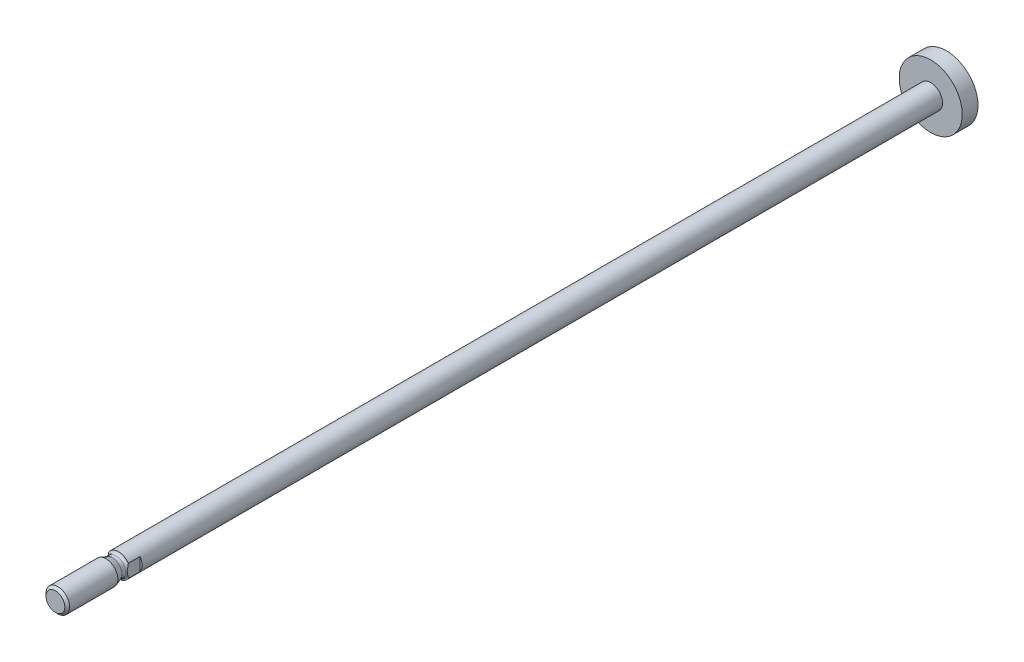
from build123d import *

# Parameters (mm, degrees)
SCHNITT_LINEAR_AUSTRAGEN1_DEPTH = 4


with BuildPart() as part:
    # Skizze1 → Rotation1 (revolve)
    with BuildSketch(Plane(origin=(0, 0, 0), x_dir=(0, 0, -1), z_dir=(1, 0, 0))):
        Polygon((-5, 0), (-5, 3), (201.2, 3), (201.2, 8), (205.2, 8), (205.2, 0), align=None)
    revolve(axis=Axis((0, 0, -205.2), (0, 0, 1)))

    # Skizze2 → Rotation2 (revolve)
    with BuildSketch(Plane(origin=(0, 0, 0), x_dir=(0, 0, -1), z_dir=(1, 0, 0))):
        with BuildLine():
            Line((-21, 0), (-21, 2.3865))
            Line((-21, 2.3865), (-20.3865, 3))
            Line((-20.3865, 3), (-8.148486452, 3))
            Line((-8.148486452, 3), (-6.599415898, 2.436184428))
            ThreePointArc((-6.599415898, 2.436184428), (-6.498392718, 2.409115348), (-6.394203812, 2.4))
            Line((-6.394203812, 2.4), (-5.6, 2.4))
            ThreePointArc((-5.6, 2.4), (-5.175735931, 2.575735931), (-5, 3))
            Line((-5, 3), (-4, 3))
            Line((-4, 3), (-4, 0))
            Line((-4, 0), (-21, 0))
        make_face()
    revolve(axis=Axis((0, 0, 4), (0, 0, 1)))

    # Skizze3 → Schnitt-Linear austragen1 (cut)
    with BuildSketch(Plane.XY.offset(2)):
        Polygon((-5, 10), (-5, -5), (-2.5, -5), (-2.5, 5), (2.5, 5), (2.5, -5), (5, -5), (5, 10), align=None)
    extrude(amount=SCHNITT_LINEAR_AUSTRAGEN1_DEPTH, mode=Mode.SUBTRACT)


solid = part.part
